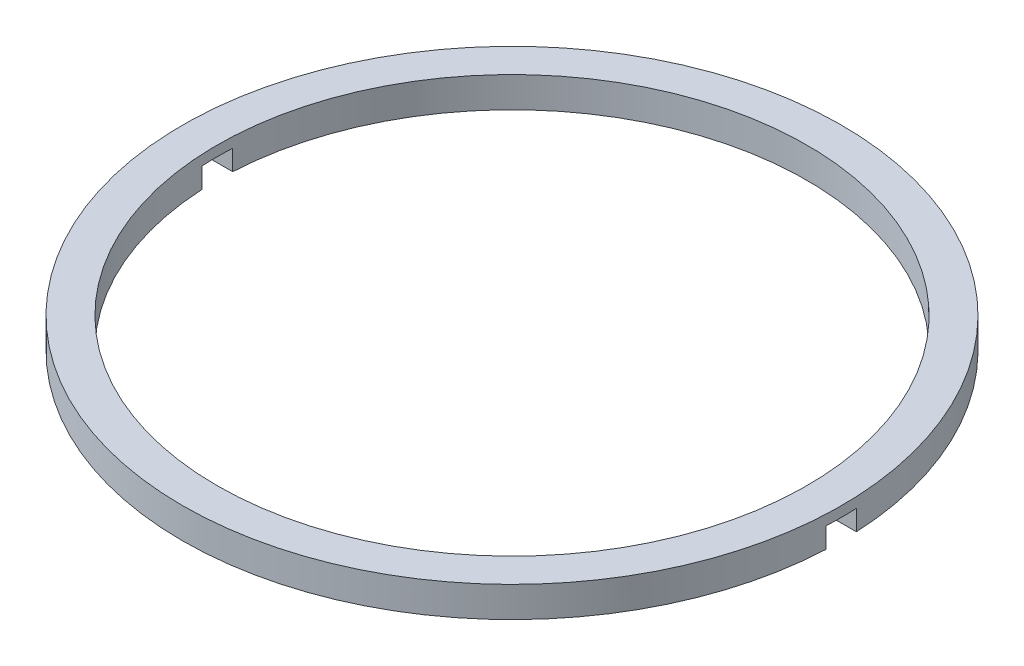
from build123d import *

# Parameters (mm, degrees)
SKETCH_2_R          = 3.24
EXTRUDE_2_DEPTH     = 0.3
CUT_EXTRUDE_1_DEPTH = 0.6
SKETCH_4_W          = 7.550166352
SKETCH_4_H          = 0.3
CUT_EXTRUDE_2_DEPTH = 0.2


with BuildPart() as part:
    # Эскиз2 → Бобышка-Вытянуть2 (new body)
    with BuildSketch(Plane(origin=(0, 0, 0), x_dir=(1, 0, 0), z_dir=(0, 1, 0))):
        with Locations(Location((0, 0, 0), (0, 0, 270))):
            Circle(SKETCH_2_R)
    extrude(amount=EXTRUDE_2_DEPTH)

    # Эскиз3 → Вырез-Вытянуть1 (cut)
    with BuildSketch(Plane.XZ):
        with BuildLine():
            Line((-2.896118092, 0.15), (2.896118092, 0.15))
            ThreePointArc((2.896118092, 0.15), (0, 2.9), (-2.896118092, 0.15))
        make_face()
        with BuildLine():
            Line((-2.896118092, -0.15), (2.896118092, -0.15))
            ThreePointArc((2.896118092, -0.15), (2.89902936, -0.075025111), (2.9, 0))
            ThreePointArc((2.9, 0), (2.89902936, 0.075025111), (2.896118092, 0.15))
            Line((2.896118092, 0.15), (-2.896118092, 0.15))
            ThreePointArc((-2.896118092, 0.15), (-2.9, 0), (-2.896118092, -0.15))
        make_face()
        with BuildLine():
            ThreePointArc((-2.896118092, -0.15), (0, -2.9), (2.896118092, -0.15))
            Line((2.896118092, -0.15), (-2.896118092, -0.15))
        make_face()
    extrude(amount=-CUT_EXTRUDE_1_DEPTH, mode=Mode.SUBTRACT)

    # Эскиз4 → Вырез-Вытянуть2 (cut)
    with BuildSketch(Plane.XZ):
        Rectangle(SKETCH_4_W, SKETCH_4_H)
    extrude(amount=-CUT_EXTRUDE_2_DEPTH, mode=Mode.SUBTRACT)


solid = part.part
